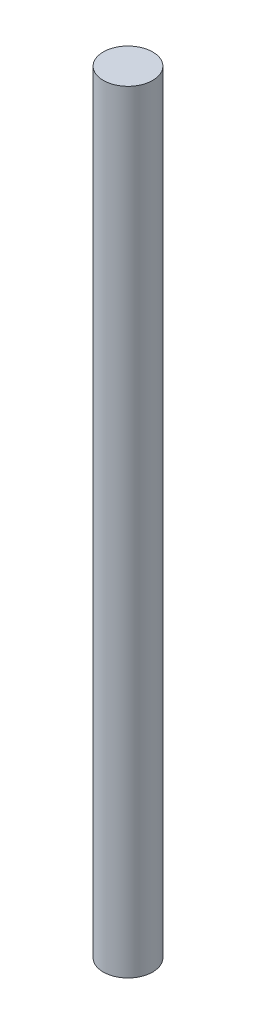
from build123d import *

# Parameters (mm, degrees)
ESBO_O1_R                = 4
RESSALTO_EXTRUS_O1_DEPTH = 125.099411275


with BuildPart() as part:
    # Esboço1 → Ressalto-extrusão1 (new body)
    with BuildSketch(Plane(origin=(0, 0, 0), x_dir=(1, 0, 0), z_dir=(0, 1, 0))):
        with Locations(Location((0, 0, 0), (0, 0, 270))):
            Circle(ESBO_O1_R)
    extrude(amount=RESSALTO_EXTRUS_O1_DEPTH)


solid = part.part
